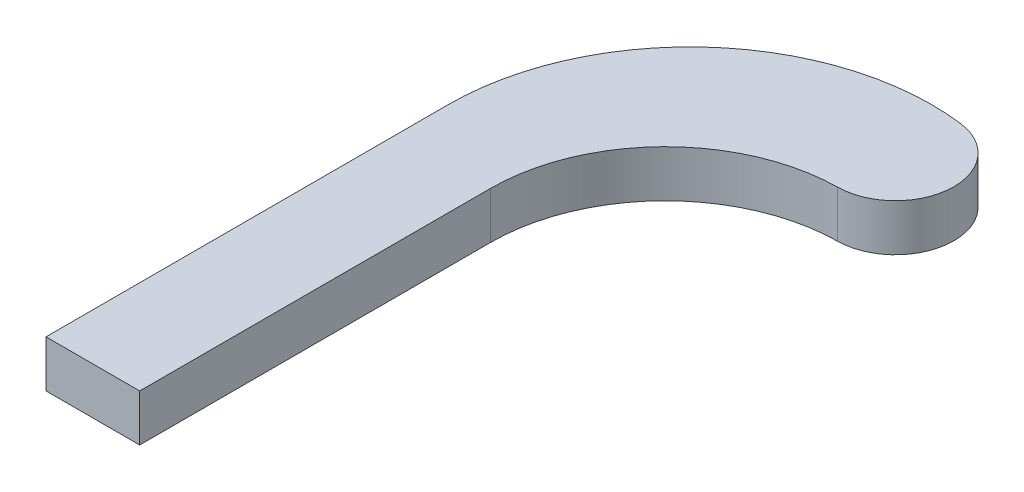
from build123d import *

# Parameters (mm, degrees)
BOSS_EXTRUDE1_DEPTH = 19.05


with BuildPart() as part:
    # Sketch1 → Boss-Extrude1 (new body)
    with BuildSketch(Plane(origin=(0, 0, 0), x_dir=(1, 0, 0), z_dir=(0, 1, 0))):
        with BuildLine():
            Line((-19.05, 142.604993733), (-19.05, 163.473390846))
            ThreePointArc((-19.05, 163.473390846), (14.378745185, 237.368638748), (91.949229987, 261.050035552))
            ThreePointArc((91.949229987, 261.050035552), (112.649599057, 236.081870166), (89.206052596, 213.669492074))
            ThreePointArc((89.206052596, 213.669492074), (39.543801874, 192.535031386), (19.05, 142.604993733))
            Line((19.05, 142.604993733), (19.05, 0))
            Line((19.05, 0), (-19.05, 0))
            Line((-19.05, 0), (-19.05, 142.604993733))
        make_face()
    extrude(amount=BOSS_EXTRUDE1_DEPTH)


solid = part.part
